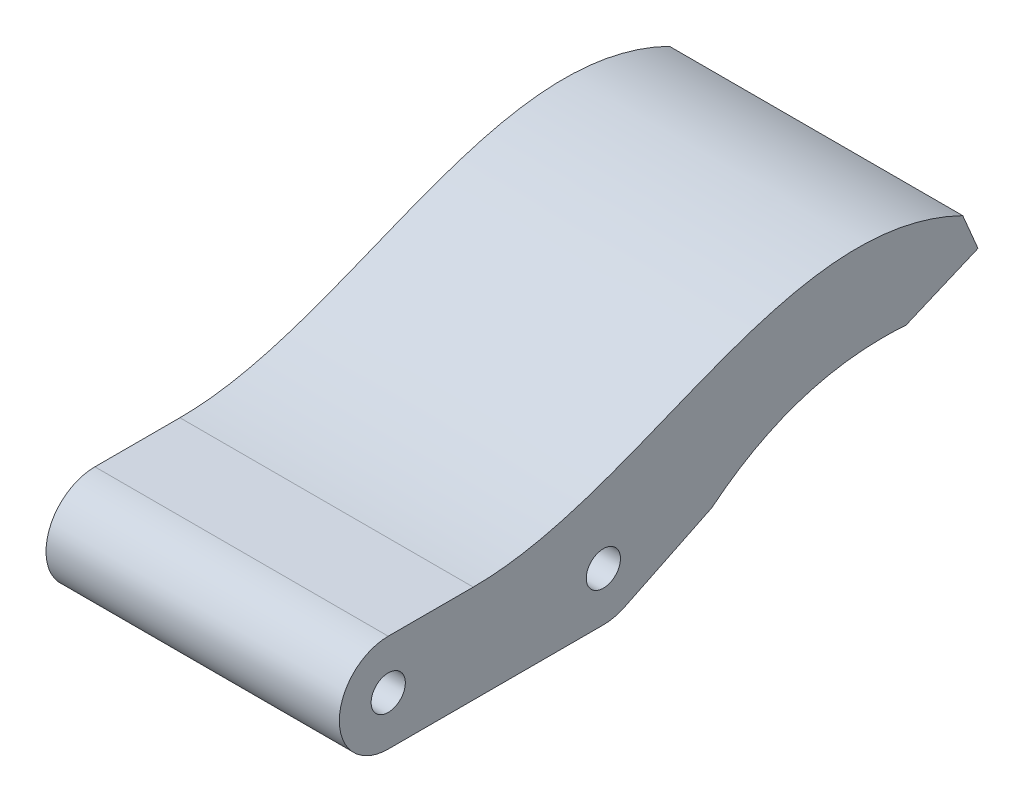
from build123d import *

# Parameters (mm, degrees)
SKETCH1_R           = 1.75
BOSS_EXTRUDE1_DEPTH = 30
BOSS_EXTRUDE2_START = -30
BOSS_EXTRUDE2_DEPTH = 30


with BuildPart() as part:
    # Sketch1 → Boss-Extrude1 (new body)
    with BuildSketch(Plane(origin=(0, 0, 0), x_dir=(0, 0, -1), z_dir=(1, 0, 0))):
        with BuildLine():
            Line((27, 10), (5, 10))
            ThreePointArc((5, 10), (0, 5), (5, 0))
            Line((5, 0), (27, 0))
            ThreePointArc((27, 0), (32, 5), (27, 10))
        make_face()
        with Locations((5, 5)):
            Circle(SKETCH1_R, mode=Mode.SUBTRACT)
        with Locations((27, 5)):
            Circle(SKETCH1_R, mode=Mode.SUBTRACT)
    extrude(amount=BOSS_EXTRUDE1_DEPTH)

    # Sketch2 → Boss-Extrude2 (add)
    with BuildSketch(Plane(origin=(30, 0, 0), x_dir=(0, 0, -1), z_dir=(1, 0, 0)).offset(BOSS_EXTRUDE2_START)):
        with BuildLine():
            add(Edge.make_bspline(
                [(63.752972286, 17.872423117), (45.928882678, 26.563787963), (31.059268621, 10), (13.694974759, 10)],
                knots=[0, 0, 0, 0, 1, 1, 1, 1], degree=3))
            Line((13.694974759, 10), (27, 10))
            ThreePointArc((27, 10), (31.87285141, 6.120410255), (29.183837075, 0.502127655))
            Line((29.183837075, 0.502127655), (38.08542066, 4.824084077))
            add(Edge.make_bspline(
                [(38.08542066, 4.824084077), (46.797509509, 11.895222457), (57.948000409, 11.067843667)],
                knots=[0, 0, 0, 1, 1, 1], degree=2))
            Line((57.948000409, 11.067843667), (65.313809691, 14.189518476))
            Line((65.313809691, 14.189518476), (63.752972286, 17.872423117))
        make_face()
    extrude(amount=BOSS_EXTRUDE2_DEPTH)


solid = part.part
